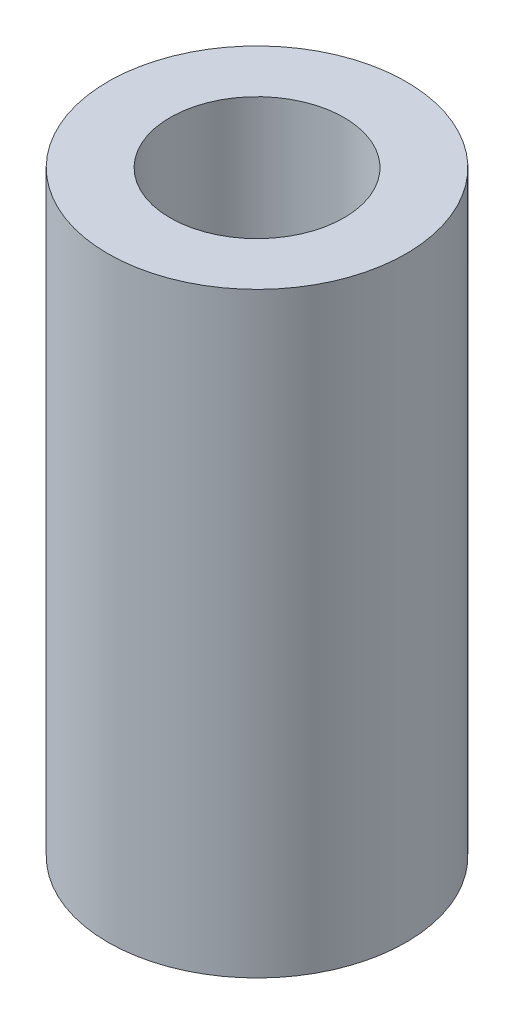
from build123d import *

# Parameters (mm, degrees)
SKETCH1_R           = 3
SKETCH1_R_2         = 1.75
BOSS_EXTRUDE1_DEPTH = 12


with BuildPart() as part:
    # Sketch1 → Boss-Extrude1 (new body)
    with BuildSketch(Plane(origin=(0, 0, 0), x_dir=(1, 0, 0), z_dir=(0, 1, 0))):
        with Locations(Location((0, 0, 0), (0, 0, 270))):
            Circle(SKETCH1_R)
        with Locations(Location((0, 0, 0), (0, 0, 270))):
            Circle(SKETCH1_R_2, mode=Mode.SUBTRACT)
    extrude(amount=BOSS_EXTRUDE1_DEPTH)


solid = part.part
